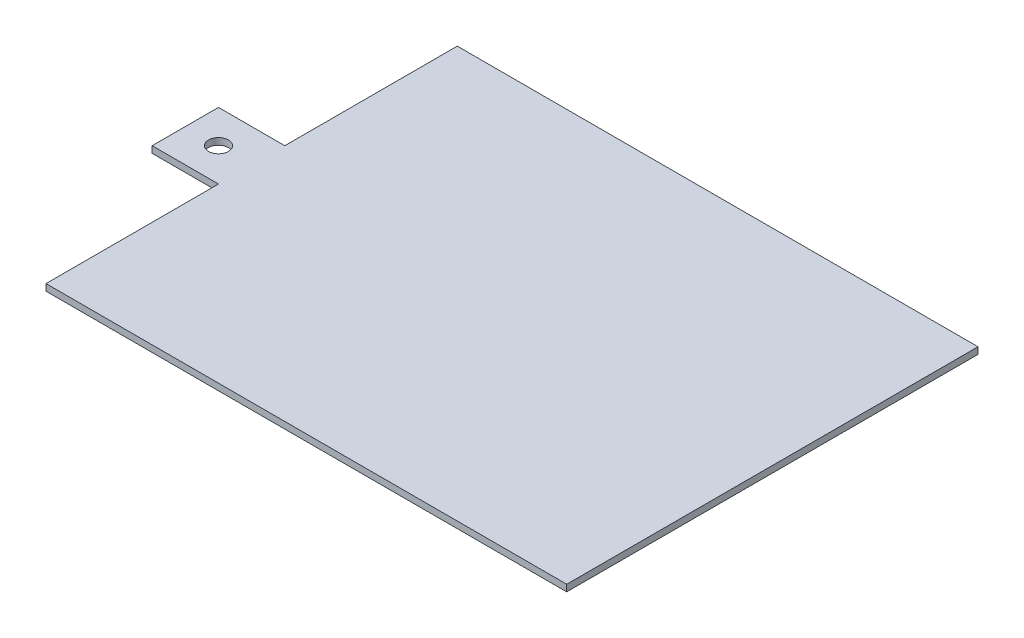
from build123d import *

# Parameters (mm, degrees)
SKETCH_1_R      = 3
EXTRUDE_1_DEPTH = 2


with BuildPart() as part:
    # ｽｹｯﾁ1 → ﾎﾞｽ - 押し出し1 (new body)
    with BuildSketch(Plane(origin=(0, 0, 0), x_dir=(1, 0, 0), z_dir=(0, 1, 0))):
        Polygon((-68.5, 62), (88.5, 62), (88.5, -62), (-68.5, -62), (-68.5, -10), (-88.5, -10), (-88.5, 10), (-68.5, 10), align=None)
        with Locations(Location((-78.5, 0, 0), (0, 0, 270))):
            Circle(SKETCH_1_R, mode=Mode.SUBTRACT)
    extrude(amount=EXTRUDE_1_DEPTH)


solid = part.part
